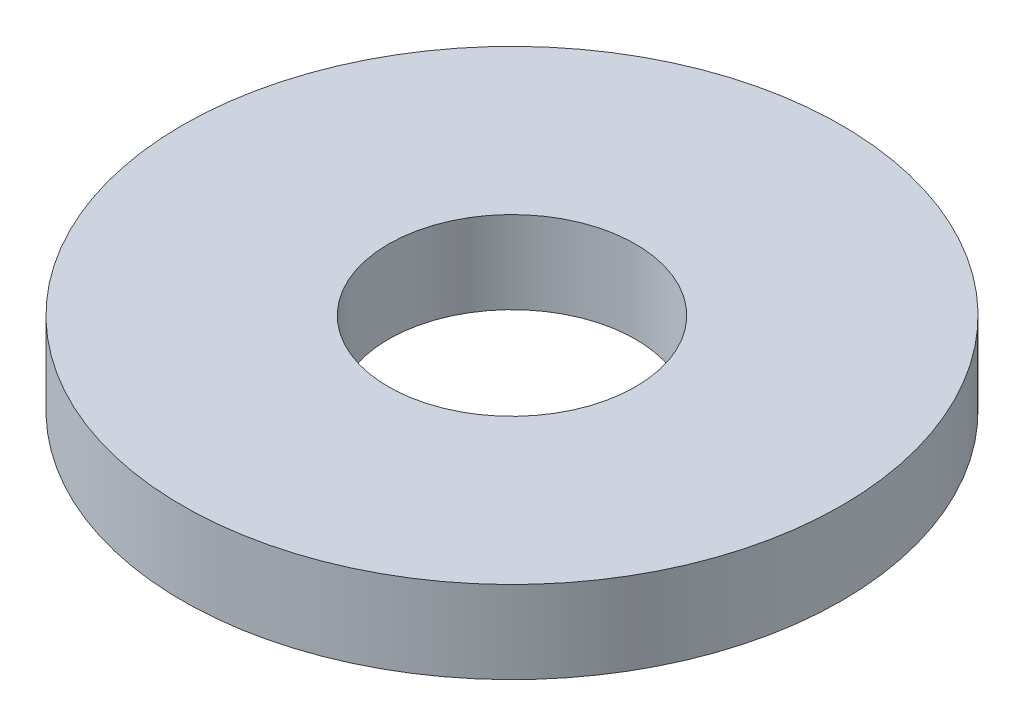
from build123d import *

# Parameters (mm, degrees)
BASE_W = 2.5
BASE_H = 1


with BuildPart() as part:
    # base → Revolution (revolve)
    with BuildSketch(Plane.XY):
        with Locations((2.75, 0)):
            Rectangle(BASE_W, BASE_H)
    revolve(axis=Axis((0, -0.5, 0), (0, 1, 0)))


solid = part.part
